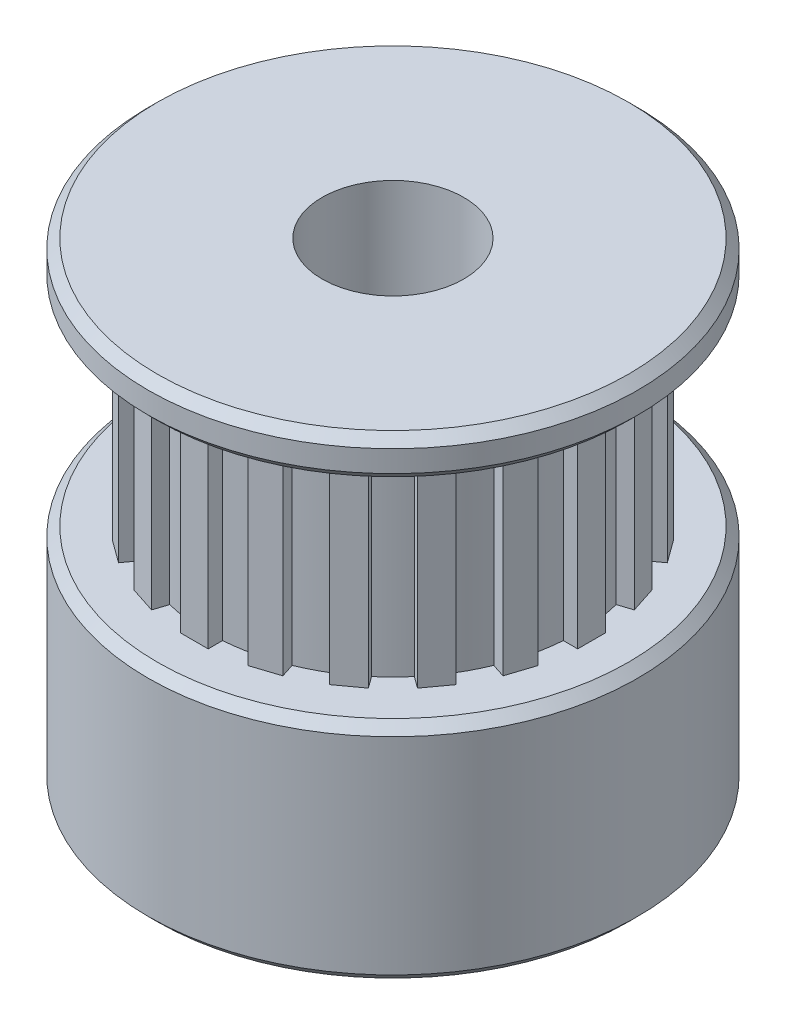
from build123d import *

# Parameters (mm, degrees)
SKETCH1_R           = 7.95
SKETCH1_R_2         = 2.3
BOSS_EXTRUDE1_DEPTH = 7.3
SKETCH2_R           = 2.3
BOSS_EXTRUDE2_DEPTH = 6.8
SKETCH3_R           = 7.95
SKETCH3_R_2         = 2.3
BOSS_EXTRUDE3_DEPTH = 1.3
CHAMFER1_SIZE       = 0.3


with BuildPart() as part:
    # Sketch1 → Boss-Extrude1 (new body)
    with BuildSketch(Plane(origin=(0, 0, 0), x_dir=(1, 0, 0), z_dir=(0, 1, 0))):
        with Locations(Location((0, 0, 0), (0, 0, 270))):
            Circle(SKETCH1_R)
        with Locations(Location((0, 0, 0), (0, 0, 270))):
            Circle(SKETCH1_R_2, mode=Mode.SUBTRACT)
    extrude(amount=BOSS_EXTRUDE1_DEPTH)

    # Sketch2 → Boss-Extrude2 (add)
    with BuildSketch(Plane(origin=(0, 7.3, 0), x_dir=(1, 0, 0), z_dir=(0, 1, 0))):
        with BuildLine():
            Line((1.565184181, 6.273372178), (1.420904518, 5.829325034))
            ThreePointArc((1.420904518, 5.829325034), (0.93860679, 5.926130044), (0.45, 5.983101203))
            Line((0.45, 5.983101203), (0.45, 6.45))
            Line((0.45, 6.45), (-0.45, 6.45))
            Line((-0.45, 6.45), (-0.45, 5.983101203))
            ThreePointArc((-0.45, 5.983101203), (-0.93860679, 5.926130044), (-1.420904518, 5.829325034))
            Line((-1.420904518, 5.829325034), (-1.565184181, 6.273372178))
            Line((-1.565184181, 6.273372178), (-2.421135046, 5.995256883))
            Line((-2.421135046, 5.995256883), (-2.276855383, 5.551209739))
            ThreePointArc((-2.276855383, 5.551209739), (-2.723942998, 5.346039145), (-3.152721002, 5.104933915))
            Line((-3.152721002, 5.104933915), (-3.42715723, 5.482662977))
            Line((-3.42715723, 5.482662977), (-4.155272525, 4.95365625))
            Line((-4.155272525, 4.95365625), (-3.880836297, 4.575927188))
            ThreePointArc((-3.880836297, 4.575927188), (-4.242640687, 4.242640687), (-4.575927188, 3.880836297))
            Line((-4.575927188, 3.880836297), (-4.95365625, 4.155272525))
            Line((-4.95365625, 4.155272525), (-5.482662977, 3.42715723))
            Line((-5.482662977, 3.42715723), (-5.104933915, 3.152721002))
            ThreePointArc((-5.104933915, 3.152721002), (-5.346039145, 2.723942998), (-5.551209739, 2.276855383))
            Line((-5.551209739, 2.276855383), (-5.995256883, 2.421135046))
            Line((-5.995256883, 2.421135046), (-6.273372178, 1.565184181))
            Line((-6.273372178, 1.565184181), (-5.829325034, 1.420904518))
            ThreePointArc((-5.829325034, 1.420904518), (-5.926130044, 0.93860679), (-5.983101203, 0.45))
            Line((-5.983101203, 0.45), (-6.45, 0.45))
            Line((-6.45, 0.45), (-6.45, -0.45))
            Line((-6.45, -0.45), (-5.983101203, -0.45))
            ThreePointArc((-5.983101203, -0.45), (-5.926130044, -0.93860679), (-5.829325034, -1.420904518))
            Line((-5.829325034, -1.420904518), (-6.273372178, -1.565184181))
            Line((-6.273372178, -1.565184181), (-5.995256883, -2.421135046))
            Line((-5.995256883, -2.421135046), (-5.551209739, -2.276855383))
            ThreePointArc((-5.551209739, -2.276855383), (-5.346039145, -2.723942998), (-5.104933915, -3.152721002))
            Line((-5.104933915, -3.152721002), (-5.482662977, -3.42715723))
            Line((-5.482662977, -3.42715723), (-4.95365625, -4.155272525))
            Line((-4.95365625, -4.155272525), (-4.575927188, -3.880836297))
            ThreePointArc((-4.575927188, -3.880836297), (-4.242640687, -4.242640687), (-3.880836297, -4.575927188))
            Line((-3.880836297, -4.575927188), (-4.155272525, -4.95365625))
            Line((-4.155272525, -4.95365625), (-3.42715723, -5.482662977))
            Line((-3.42715723, -5.482662977), (-3.152721002, -5.104933915))
            ThreePointArc((-3.152721002, -5.104933915), (-2.723942998, -5.346039145), (-2.276855383, -5.551209739))
            Line((-2.276855383, -5.551209739), (-2.421135046, -5.995256883))
            Line((-2.421135046, -5.995256883), (-1.565184181, -6.273372178))
            Line((-1.565184181, -6.273372178), (-1.420904518, -5.829325034))
            ThreePointArc((-1.420904518, -5.829325034), (-0.93860679, -5.926130044), (-0.45, -5.983101203))
            Line((-0.45, -5.983101203), (-0.45, -6.45))
            Line((-0.45, -6.45), (0.45, -6.45))
            Line((0.45, -6.45), (0.45, -5.983101203))
            ThreePointArc((0.45, -5.983101203), (0.93860679, -5.926130044), (1.420904518, -5.829325034))
            Line((1.420904518, -5.829325034), (1.565184181, -6.273372178))
            Line((1.565184181, -6.273372178), (2.421135046, -5.995256883))
            Line((2.421135046, -5.995256883), (2.276855383, -5.551209739))
            ThreePointArc((2.276855383, -5.551209739), (2.723942998, -5.346039145), (3.152721002, -5.104933915))
            Line((3.152721002, -5.104933915), (3.42715723, -5.482662977))
            Line((3.42715723, -5.482662977), (4.155272525, -4.95365625))
            Line((4.155272525, -4.95365625), (3.880836297, -4.575927188))
            ThreePointArc((3.880836297, -4.575927188), (4.242640687, -4.242640687), (4.575927188, -3.880836297))
            Line((4.575927188, -3.880836297), (4.95365625, -4.155272525))
            Line((4.95365625, -4.155272525), (5.482662977, -3.42715723))
            Line((5.482662977, -3.42715723), (5.104933915, -3.152721002))
            ThreePointArc((5.104933915, -3.152721002), (5.346039145, -2.723942998), (5.551209739, -2.276855383))
            Line((5.551209739, -2.276855383), (5.995256883, -2.421135046))
            Line((5.995256883, -2.421135046), (6.273372178, -1.565184181))
            Line((6.273372178, -1.565184181), (5.829325034, -1.420904518))
            ThreePointArc((5.829325034, -1.420904518), (5.926130044, -0.93860679), (5.983101203, -0.45))
            Line((5.983101203, -0.45), (6.45, -0.45))
            Line((6.45, -0.45), (6.45, 0.45))
            Line((6.45, 0.45), (5.983101203, 0.45))
            ThreePointArc((5.983101203, 0.45), (5.926130044, 0.93860679), (5.829325034, 1.420904518))
            Line((5.829325034, 1.420904518), (6.273372178, 1.565184181))
            Line((6.273372178, 1.565184181), (5.995256883, 2.421135046))
            Line((5.995256883, 2.421135046), (5.551209739, 2.276855383))
            ThreePointArc((5.551209739, 2.276855383), (5.346039145, 2.723942998), (5.104933915, 3.152721002))
            Line((5.104933915, 3.152721002), (5.482662977, 3.42715723))
            Line((5.482662977, 3.42715723), (4.95365625, 4.155272525))
            Line((4.95365625, 4.155272525), (4.575927188, 3.880836297))
            ThreePointArc((4.575927188, 3.880836297), (4.242640687, 4.242640687), (3.880836297, 4.575927188))
            Line((3.880836297, 4.575927188), (4.155272525, 4.95365625))
            Line((4.155272525, 4.95365625), (3.42715723, 5.482662977))
            Line((3.42715723, 5.482662977), (3.152721002, 5.104933915))
            ThreePointArc((3.152721002, 5.104933915), (2.723942998, 5.346039145), (2.276855383, 5.551209739))
            Line((2.276855383, 5.551209739), (2.421135046, 5.995256883))
            Line((2.421135046, 5.995256883), (1.565184181, 6.273372178))
        make_face()
        with Locations(Location((0, 0, 0), (0, 0, 270))):
            Circle(SKETCH2_R, mode=Mode.SUBTRACT)
    extrude(amount=BOSS_EXTRUDE2_DEPTH)

    # Sketch3 → Boss-Extrude3 (add)
    with BuildSketch(Plane(origin=(0, 14.1, 0), x_dir=(1, 0, 0), z_dir=(0, 1, 0))):
        with Locations(Location((0, 0, 0), (0, 0, 270))):
            Circle(SKETCH3_R)
        with Locations(Location((0, 0, 0), (0, 0, 270))):
            Circle(SKETCH3_R_2, mode=Mode.SUBTRACT)
    extrude(amount=BOSS_EXTRUDE3_DEPTH)

    # Chamfer1
    chamfer1_edges = [part.edges().sort_by_distance(p)[0] for p in [
        (0, 0, -7.95),
        (0, 15.4, -7.95),
        (0, 14.1, -7.95),
        (0, 7.3, -7.95),
    ]]
    chamfer(chamfer1_edges, length=CHAMFER1_SIZE)


solid = part.part
